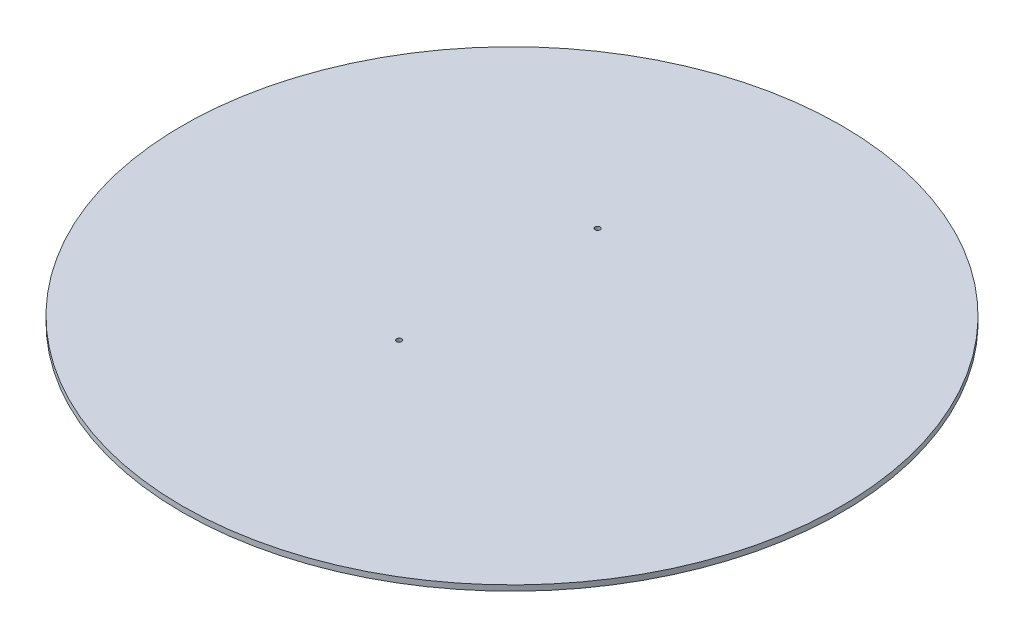
from build123d import *

# Parameters (mm, degrees)
SKETCH2_R           = 304.8
BOSS_EXTRUDE1_DEPTH = 5.08
SKETCH3_R           = 2.3495
CUT_EXTRUDE1_DEPTH  = 551.227709234


with BuildPart() as part:
    # Sketch2 → Boss-Extrude1 (new body)
    with BuildSketch(Plane(origin=(0, 0, 0), x_dir=(1, 0, 0), z_dir=(0, 1, 0))):
        with Locations(Location((0, 0, 0), (0, 0, 270))):
            Circle(SKETCH2_R)
    extrude(amount=BOSS_EXTRUDE1_DEPTH)

    # Sketch3 → Cut-Extrude1 (cut, through all)
    with BuildSketch(Plane(origin=(-66.634045458, 80.024593283, -93.174052362), x_dir=(0.9941524009920281, -0.1079843831563281, -0.0006136742891854778), z_dir=(0.10794896477866957, 0.99364514955026, 0.03188005298701745))):
        with Locations(Location((41.721218349, -167.120322092, 0), (0, 0, 343.610574901))):
            Circle(SKETCH3_R)
        with Locations(Location((44.049502294, 14.21950649, 0), (0, 0, 343.610574901))):
            Circle(SKETCH3_R)
    extrude(amount=-CUT_EXTRUDE1_DEPTH, mode=Mode.SUBTRACT)


solid = part.part
